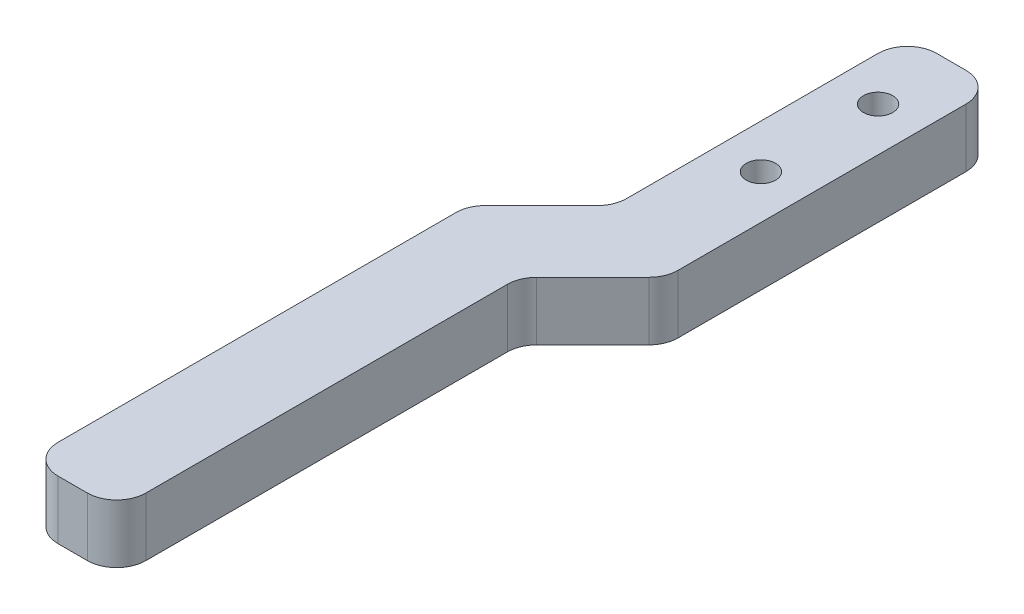
from build123d import *

# Parameters (mm, degrees)
SKETCH_1_R      = 1
EXTRUDE_1_DEPTH = 4
FILLET_1_R      = 2


with BuildPart() as part:
    # 草图1 → 凸台-拉伸1 (new body)
    with BuildSketch(Plane(origin=(0, 0, 0), x_dir=(1, 0, 0), z_dir=(0, 1, 0))):
        Polygon((25, 30), (25, 40), (30, 45), (30, 65), (36, 65), (36, 42.514718626), (31, 37.514718626), (31, 25.514718626), (31, 10), (25, 10), align=None)
        with Locations(Location((33, 60, 0), (0, 0, 270))):
            Circle(SKETCH_1_R, mode=Mode.SUBTRACT)
        with Locations(Location((33, 52, 0), (0, 0, 270))):
            Circle(SKETCH_1_R, mode=Mode.SUBTRACT)
    extrude(amount=EXTRUDE_1_DEPTH)

    # 圆角1
    fillet_1_edges = [part.edges().sort_by_distance(p)[0] for p in [
        (25, 2, -40),
        (30, 2, -45),
        (30, 2, -65),
        (36, 2, -65),
        (36, 2, -42.514718626),
        (31, 2, -37.514718626),
        (31, 2, -10),
        (25, 2, -10),
    ]]
    fillet(fillet_1_edges, radius=FILLET_1_R)


solid = part.part
